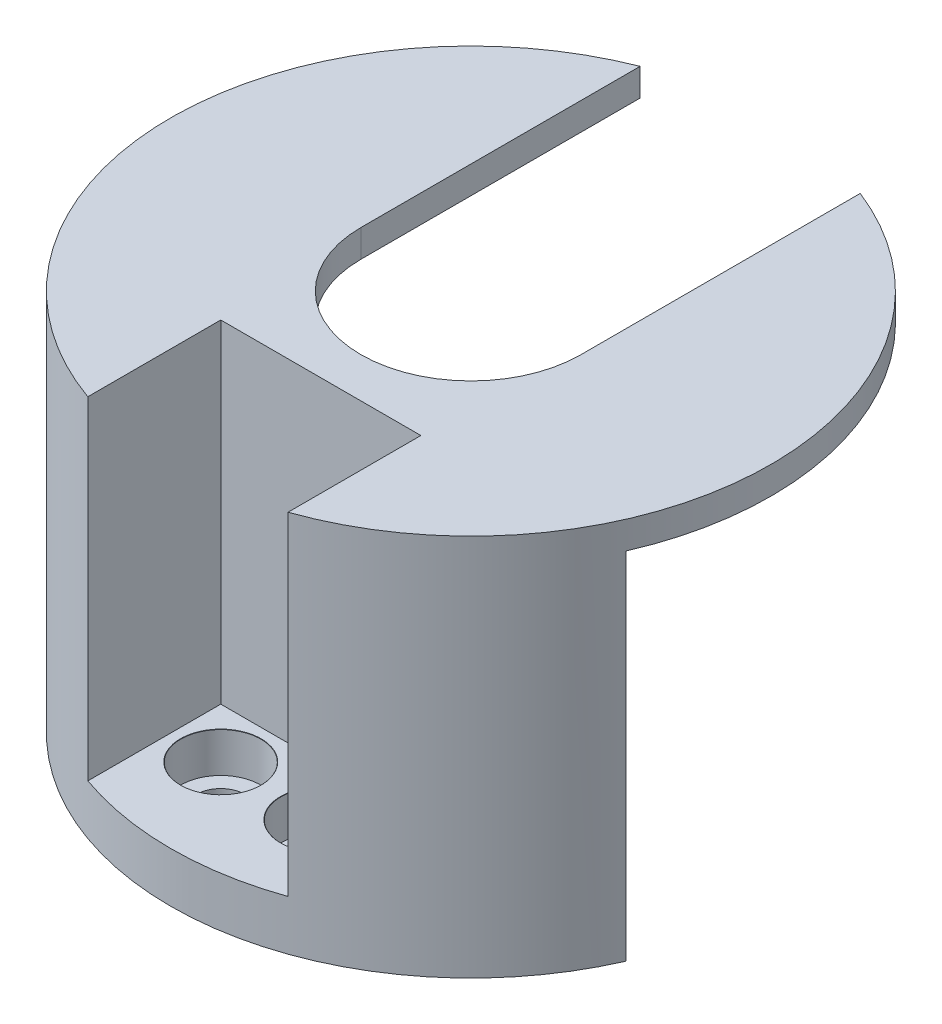
from build123d import *

# Parameters (mm, degrees)
SKETCH1_R                     = 30
BOSS_EXTRUDE1_DEPTH           = 19.125
SKETCH5_W                     = 42
SKETCH5_H                     = 35.5
CUT_EXTRUDE1_DEPTH            = 52.5
SKETCH7_R                     = 11
SKETCH7_W                     = 22
SKETCH7_H                     = 50
CUT_EXTRUDE3_DEPTH            = 52.5
CUT_EXTRUDE4_DEPTH            = 33.25
CBORE_FOR_M4_SHCS1_AT_2_COUNT = 2
CBORE_FOR_M4_SHCS1_AT_2_PITCH = 10


with BuildPart() as part:
    # Sketch1 → Boss-Extrude1 (new, symmetric)
    with BuildSketch(Plane(origin=(0, 0, 0), x_dir=(1, 0, 0), z_dir=(0, 1, 0))):
        with Locations(Location((0, 0, 0), (0, 0, 270))):
            Circle(SKETCH1_R)
    extrude(amount=BOSS_EXTRUDE1_DEPTH, both=True)

    # Sketch5 → Cut-Extrude1 (cut, symmetric)
    with BuildSketch(Plane(origin=(0, 0, 0), x_dir=(0, 0, -1), z_dir=(1, 0, 0))):
        with Locations((9, -1.375)):
            Rectangle(SKETCH5_W, SKETCH5_H)
    extrude(amount=CUT_EXTRUDE1_DEPTH, both=True, mode=Mode.SUBTRACT)

    # Sketch7 → Cut-Extrude3 (cut, symmetric)
    with BuildSketch(Plane(origin=(0, 19.125, 0), x_dir=(1, 0, 0), z_dir=(0, 1, 0))):
        Circle(SKETCH7_R)
        with Locations((0, 25)):
            Rectangle(SKETCH7_W, SKETCH7_H)
    extrude(amount=CUT_EXTRUDE3_DEPTH, both=True, mode=Mode.SUBTRACT)

    # Sketch8 → Cut-Extrude4 (cut)
    with BuildSketch(Plane(origin=(0, 19.125, 0), x_dir=(1, 0, 0), z_dir=(0, 1, 0))):
        with BuildLine():
            Line((10, -28.284271247), (10, -15))
            Line((10, -15), (-10, -15))
            Line((-10, -15), (-10, -28.284271247))
            ThreePointArc((-10, -28.284271247), (-5.073059353, -29.567956791), (1.8e-08, -30))
            ThreePointArc((1.8e-08, -30), (5.07305937, -29.567956788), (10, -28.284271247))
        make_face()
    extrude(amount=-CUT_EXTRUDE4_DEPTH, mode=Mode.SUBTRACT)

    # Sketch11 → CBORE for M4 SHCS1 (revolve, cut)
    with BuildSketch(Plane(origin=(-5, -14.125, 20), x_dir=(0, 0, 1), z_dir=(1, 0, 0))):
        Polygon((0, 0), (0, 7.442065486), (2.4, 6), (2.4, 4), (4, 4), (4, 0.025), (4.025, 0), align=None)
    cbore_for_m4_shcs1 = revolve(axis=Axis((-5, -7.775, 20), (0, -1, 0)), mode=Mode.SUBTRACT)

    # CBORE for M4 SHCS1 at 2: CBORE for M4 SHCS1 ×2
    with Locations(*[(i * CBORE_FOR_M4_SHCS1_AT_2_PITCH, 0, 0) for i in range(1, CBORE_FOR_M4_SHCS1_AT_2_COUNT)]):
        add(cbore_for_m4_shcs1, mode=Mode.SUBTRACT)


solid = part.part
